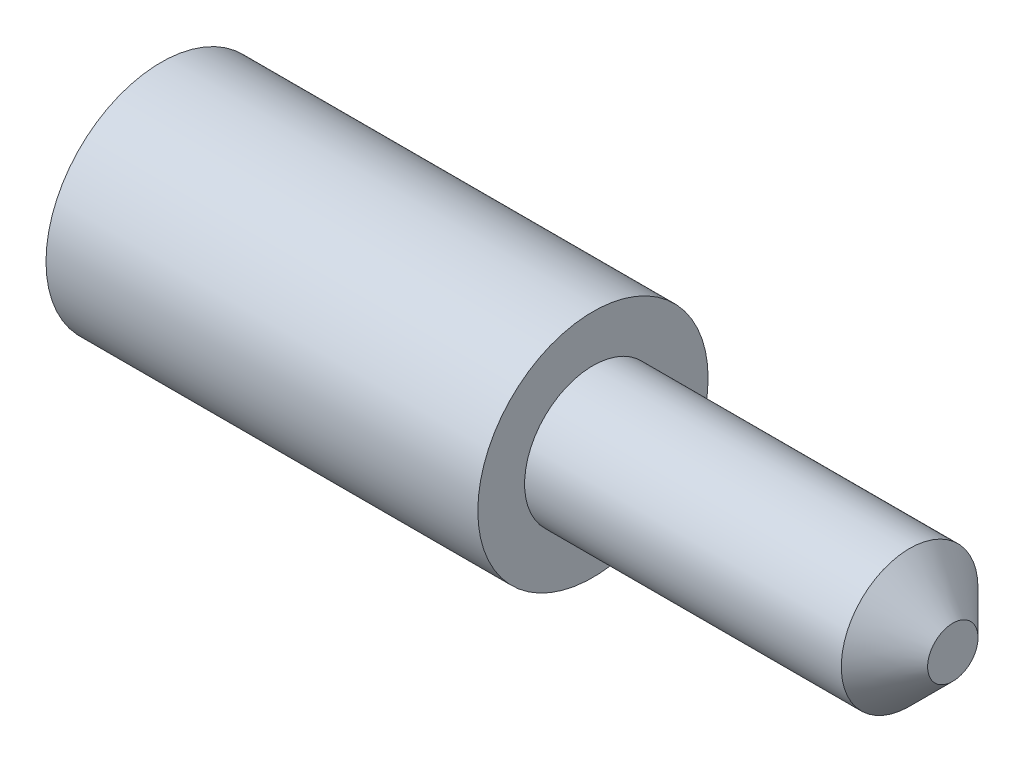
from build123d import *

# Parameters (mm, degrees)
SKETCH_1_R      = 8
EXTRUDE_1_DEPTH = 30
SKETCH_2_R      = 4.75
EXTRUDE_2_DEPTH = 25
CHAMFER_1_SIZE  = 3


with BuildPart() as part:
    # Эскиз1 → Бобышка-Вытянуть1 (new body)
    with BuildSketch(Plane(origin=(0, 0, 0), x_dir=(0, 0, -1), z_dir=(1, 0, 0))):
        Circle(SKETCH_1_R)
    extrude(amount=-EXTRUDE_1_DEPTH)

    # Эскиз2 → Бобышка-Вытянуть2 (add)
    with BuildSketch(Plane(origin=(0, 0, 0), x_dir=(0, 0, -1), z_dir=(1, 0, 0))):
        Circle(SKETCH_2_R)
    extrude(amount=EXTRUDE_2_DEPTH)

    # Фаска1
    chamfer_1_edges = [part.edges().sort_by_distance(p)[0] for p in [
        (25, 0, 4.75),
    ]]
    chamfer(chamfer_1_edges, length=CHAMFER_1_SIZE)


solid = part.part
